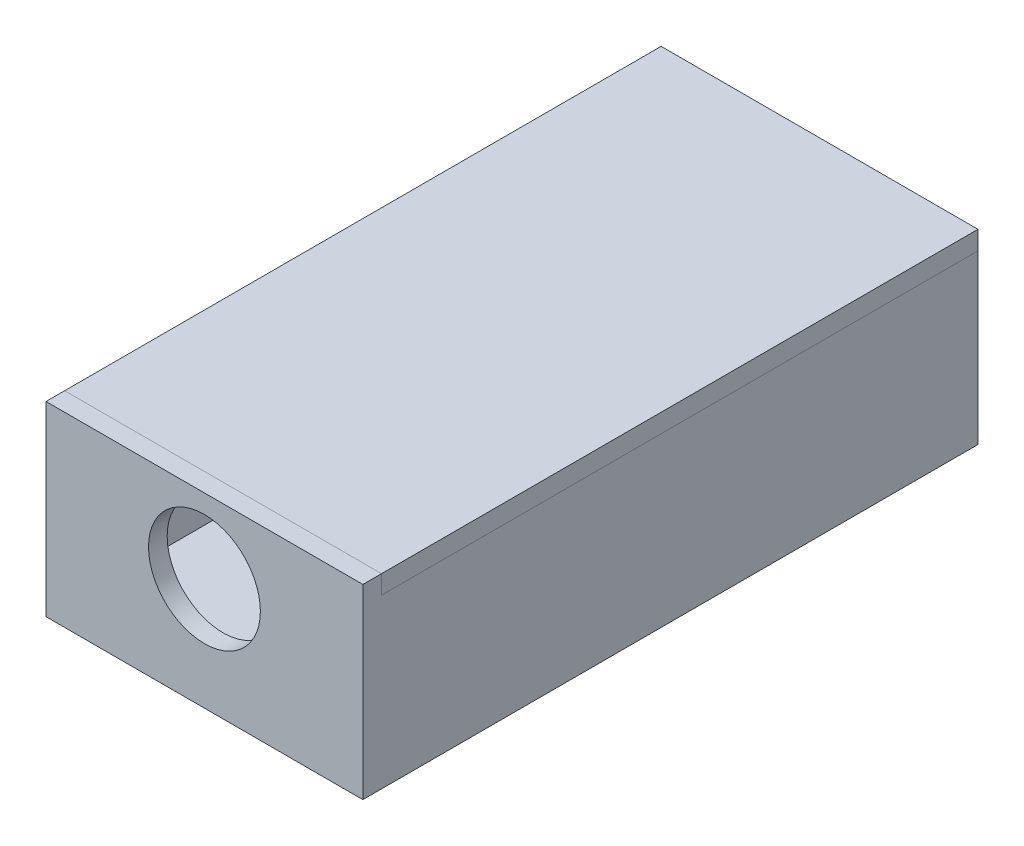
from build123d import *

# Parameters (mm, degrees)
SKETCH_1_W          = 17
SKETCH_1_H          = 33
EXTRUDE_1_DEPTH     = 10
CUT_EXTRUDE_START   = 1
SKETCH_2_W          = 15
SKETCH_2_H          = 32
CUT_EXTRUDE_1_DEPTH = 8
SKETCH_3_R          = 3
CUT_EXTRUDE_2_DEPTH = 22.083168642
CUT_EXTRUDE_START_2 = 9
SKETCH_5_W          = 17
SKETCH_5_H          = 32
CUT_EXTRUDE_3_DEPTH = 8
EXTRUDE_START       = 9
SKETCH_6_W          = 17
SKETCH_6_H          = 32
EXTRUDE_2_DEPTH     = 1


with BuildPart() as part:
    # 스케치1 → 보스-돌출1 (new body)
    with BuildSketch(Plane(origin=(0, 0, 0), x_dir=(1, 0, 0), z_dir=(0, 1, 0))):
        Rectangle(SKETCH_1_W, SKETCH_1_H)
    extrude(amount=EXTRUDE_1_DEPTH)

    # 스케치2 → 컷-돌출1 (cut)
    with BuildSketch(Plane(origin=(0, 0, 0), x_dir=(1, 0, 0), z_dir=(0, 1, 0)).offset(CUT_EXTRUDE_START)):
        with Locations((0, 0.5)):
            Rectangle(SKETCH_2_W, SKETCH_2_H)
    extrude(amount=CUT_EXTRUDE_1_DEPTH, mode=Mode.SUBTRACT)

    # 스케치3 → 컷-돌출2 (cut, through all)
    with BuildSketch(Plane.XY):
        with Locations(Location((0, 6, 0), (0, 0, 90))):
            Circle(SKETCH_3_R)
    extrude(amount=CUT_EXTRUDE_2_DEPTH, mode=Mode.SUBTRACT)

    # 스케치5 → 컷-돌출3 (cut)
    with BuildSketch(Plane(origin=(0, 0, 0), x_dir=(1, 0, 0), z_dir=(0, 1, 0)).offset(CUT_EXTRUDE_START_2)):
        with Locations((0, 0.5)):
            Rectangle(SKETCH_5_W, SKETCH_5_H)
    extrude(amount=CUT_EXTRUDE_3_DEPTH, mode=Mode.SUBTRACT)


with BuildPart() as body_2:
    # 스케치6 → 보스-돌출2 (new body)
    with BuildSketch(Plane(origin=(0, 0, 0), x_dir=(1, 0, 0), z_dir=(0, 1, 0)).offset(EXTRUDE_START)):
        with Locations((0, 0.5)):
            Rectangle(SKETCH_6_W, SKETCH_6_H)
    extrude(amount=EXTRUDE_2_DEPTH)


solid = Compound([part.part, body_2.part])
